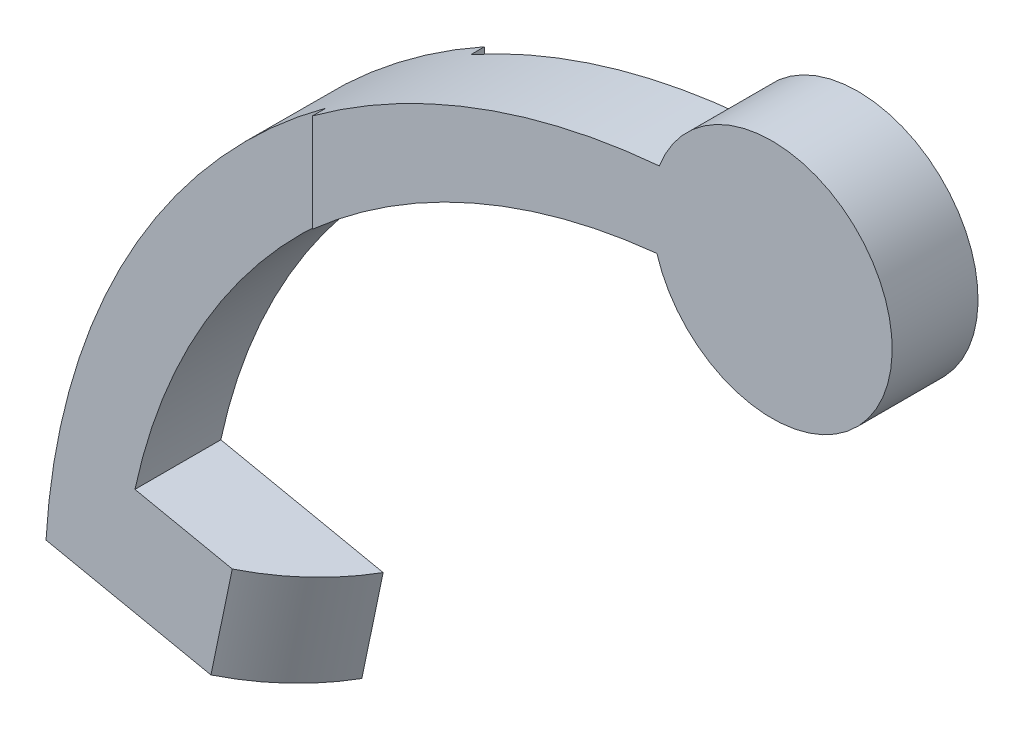
from build123d import *

# Parameters (mm, degrees)
BOSS_EXTRU_2_DEPTH      = 5
BOSS_EXTRU_3_DEPTH      = 45
ENL_V_START             = -73.880031702
ENL_V_MAT_EXTRU_3_DEPTH = 78.880031702
ESQUISSE4_4_W           = 16.307493561
ESQUISSE4_4_H           = 0.792049354
ENL_V_MAT_EXTRU_4_DEPTH = 58.619847767
ENL_V_MAT_EXTRU_6_DEPTH = 57.248456757
ENL_V_MAT_EXTRU_7_DEPTH = 58.619847767


with BuildPart() as part:
    # Esquisse3 → Boss.-Extru.2 (new body)
    with BuildSketch(Plane.XY):
        with BuildLine():
            ThreePointArc((7, 0), (1.246257582, 6.888166813), (-6.556240583, 2.452694319))
            ThreePointArc((-6.556240583, 2.452694319), (-6.99644453, 0.22307834), (-6.699170831, -2.030051767))
            ThreePointArc((-6.699170831, -2.030051767), (1.026110175, -6.924384298), (7, 0))
        make_face()
    extrude(amount=BOSS_EXTRU_2_DEPTH)

    # Esquisse3<3> → Boss.-Extru.3 (add)
    with BuildSketch(Plane.XY):
        with BuildLine():
            ThreePointArc((-6.556240583, 2.452694319), (-31.795381091, -9.503990443), (-43.059714875, -35.059641647))
            Line((-43.059714875, -35.059641647), (-29.67043681, -37.846531887))
            Line((-29.67043681, -37.846531887), (-28.42882324, -31.881349224))
            Line((-28.42882324, -31.881349224), (-37.880972605, -29.913946449))
            ThreePointArc((-37.880972605, -29.913946449), (-26.825365644, -10.900303142), (-6.699170831, -2.030051767))
            ThreePointArc((-6.699170831, -2.030051767), (-6.99644453, 0.22307834), (-6.556240583, 2.452694319))
        make_face()
    boss_extru_3 = extrude(amount=BOSS_EXTRU_3_DEPTH)

    # Esquisse4 → Enlèv. mat.-Extru.3 (cut)
    with BuildSketch(Plane(origin=(0, 0, 0), x_dir=(1, 0, 0), z_dir=(0, 1, 0)).offset(ENL_V_START)):
        Polygon((-6.556240583, -21.643777245), (-6.556240583, -5), (-22.534905521, -5), (-22.534905521, -5.792049354), (-43.059714875, -5.792049354), (-43.059714875, -11.918484986), (-43.059714875, -45), (-43.059714875, -53.527020644), (-6.425184121, -53.527020644), align=None)
    enl_v_mat_extru_3 = extrude(amount=ENL_V_MAT_EXTRU_3_DEPTH, mode=Mode.SUBTRACT)

    # Esquisse4<4> → Enlèv. mat.-Extru.4 (cut, through all)
    with BuildSketch(Plane(origin=(0, 0, 0), x_dir=(1, 0, 0), z_dir=(0, 1, 0))):
        with Locations((-34.905968095, -0.396024677)):
            Rectangle(ESQUISSE4_4_W, ESQUISSE4_4_H)
    enl_v_mat_extru_4 = extrude(amount=-ENL_V_MAT_EXTRU_4_DEPTH, mode=Mode.SUBTRACT)

    # Esquisse5 → Enlèv. mat.-Extru.6 (cut, through all)
    with BuildSketch(Plane(origin=(-7.540837864, -36.229046112, 0), x_dir=(0.9790175257089632, -0.2037760642340011, 0), z_dir=(0.2037760642340011, 0.9790175257089632, 0))):
        with BuildLine():
            Line((-25.202181908, -0.792049354), (-21.33566032, -0.792049354))
            Line((-21.33566032, -0.792049354), (-21.33566032, -5.792049354))
            ThreePointArc((-21.33566032, -5.792049354), (-22.966477925, -3.05816873), (-25.202181908, -0.792049354))
        make_face()
    enl_v_mat_extru_6 = extrude(amount=-ENL_V_MAT_EXTRU_6_DEPTH, mode=Mode.SUBTRACT)

    # Symétrie1: Boss.-Extru.3, Enlèv. mat.-Extru.3, Enlèv. mat.-Extru.4, Enlèv. mat.-Extru.6 across plane
    add(boss_extru_3.mirror(Plane.XY.offset(2.5)))
    add(enl_v_mat_extru_3.mirror(Plane.XY.offset(2.5)), mode=Mode.SUBTRACT)
    add(enl_v_mat_extru_4.mirror(Plane.XY.offset(2.5)), mode=Mode.SUBTRACT)
    add(enl_v_mat_extru_6.mirror(Plane.XY.offset(2.5)), mode=Mode.SUBTRACT)

    # Esquisse6 → Enlèv. mat.-Extru.7 (cut, through all)
    with BuildSketch(Plane(origin=(0, 0, 0), x_dir=(1, 0, 0), z_dir=(0, 1, 0))):
        Polygon((-22.534905521, -1196.824915859), (-22.534905521, -5), (-43.059714875, -5), (-43.059714875, -5.792049354), (-28.70402214, -5.792049354), align=None)
    extrude(amount=-ENL_V_MAT_EXTRU_7_DEPTH, mode=Mode.SUBTRACT)


solid = part.part
